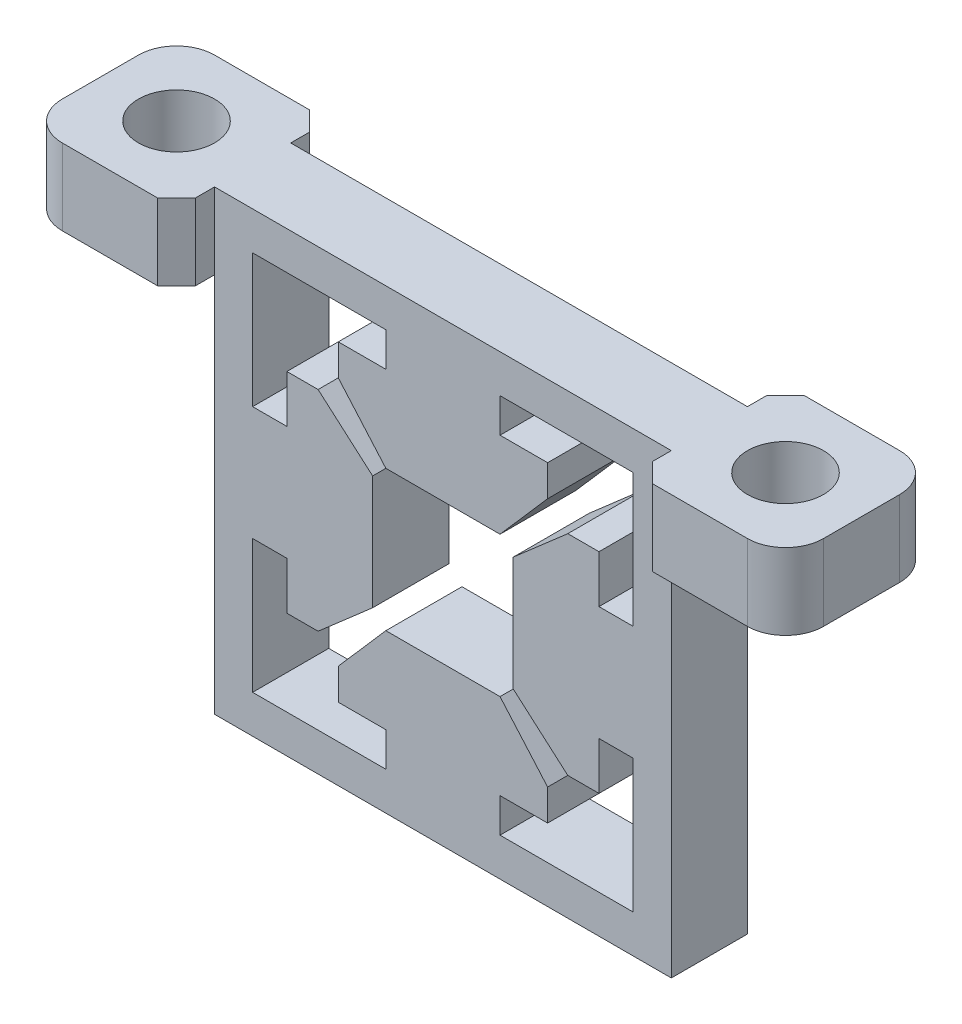
from build123d import *

# Parameters (mm, degrees)
SKETCH_1_W                 = 24
SKETCH_1_H                 = 24
EXTRUDE_1_DEPTH            = 4
SKETCH_6_R                 = 2
EXTRUDE_2_DEPTH            = 4
CHAMFER_1_SIZE             = 1
CHAMFER_1_OF_MIRROR_1_SIZE = 1


with BuildPart() as part:
    # Эскиз1 → Бобышка-Вытянуть1 (new body)
    # profile 1 of 5: a face of its own
    with BuildSketch(Plane.XY):
        Rectangle(SKETCH_1_W, SKETCH_1_H)
        Polygon((-3, 10), (0, 10), (3, 10), (5.5, 10), (10, 10), (10, 3), (10, -3), (10, -10), (3, -10), (-3, -10), (-10, -10), (-10, -3), (-10, 3), (-10, 10), (-5.5, 10), align=None, mode=Mode.SUBTRACT)
    # profile 2 of 5: a face of its own
    with BuildSketch(Plane.XY):
        Polygon((-3, -10), (3, -10), (3, -8.2), (5.5, -8.2), (5.5, -6.56), (3, -3.693992791), (-3, -3.693992791), (-5.5, -6.56), (-5.5, -8.2), (-3, -8.2), align=None)
    # profile 3 of 5: a face of its own
    with BuildSketch(Plane.XY):
        Polygon((10, -3), (10, 3), (8.2, 3), (8.2, 5.5), (6.56, 5.5), (3.693992791, 3), (3.693992791, -3), (6.56, -5.5), (8.2, -5.5), (8.2, -3), align=None)
    # profile 4 of 5: a face of its own
    with BuildSketch(Plane.XY):
        Polygon((-8.2, 3), (-10, 3), (-10, -3), (-8.2, -3), (-8.2, -5.5), (-6.56, -5.5), (-3.693992791, -3), (-3.693992791, 3), (-6.56, 5.5), (-8.2, 5.5), align=None)
    # profile 5 of 5: a face of its own
    with BuildSketch(Plane.XY):
        Polygon((3, 10), (0, 10), (-3, 10), (-3, 8.2), (-5.5, 8.2), (-5.5, 6.56), (-3, 3.693992791), (3, 3.693992791), (5.5, 6.56), (5.5, 8.2), (3, 8.2), align=None)
    extrude(amount=EXTRUDE_1_DEPTH)

    # Эскиз6 → Бобышка-Вытянуть2 (add)
    with BuildSketch(Plane(origin=(0, 12, 0), x_dir=(1, 0, 0), z_dir=(0, 1, 0))):
        with BuildLine():
            Line((-12, 2), (-18, 2))
            ThreePointArc((-18, 2), (-19.414213562, 1.414213562), (-20, 0))
            Line((-20, 0), (-20, -4))
            ThreePointArc((-20, -4), (-19.414213562, -5.414213562), (-18, -6))
            Line((-18, -6), (-12, -6))
            Line((-12, -6), (-12, 2))
        make_face()
        with Locations(Location((-16, -2, 0), (0, 0, 270))):
            Circle(SKETCH_6_R, mode=Mode.SUBTRACT)
    extrude_2 = extrude(amount=-EXTRUDE_2_DEPTH)

    # Фаска1
    chamfer_1_edges = [part.edges().sort_by_distance(p)[0] for p in [
        (-12, 10, -2),
        (-12, 10, 6),
    ]]
    chamfer(chamfer_1_edges, length=CHAMFER_1_SIZE)

    # Зеркальное отражение1: Бобышка-Вытянуть2 across plane
    add(extrude_2.mirror(Plane(origin=(0, 0, 0), x_dir=(0, 0, 1), z_dir=(1, 0, 0))))

    # Фаска1 of Зеркальное отражение1
    chamfer_1_of_mirror_1_edges = [part.edges().sort_by_distance(p)[0] for p in [
        (12, 10, -2),
        (12, 10, 6),
    ]]
    chamfer(chamfer_1_of_mirror_1_edges, length=CHAMFER_1_OF_MIRROR_1_SIZE)


solid = part.part
